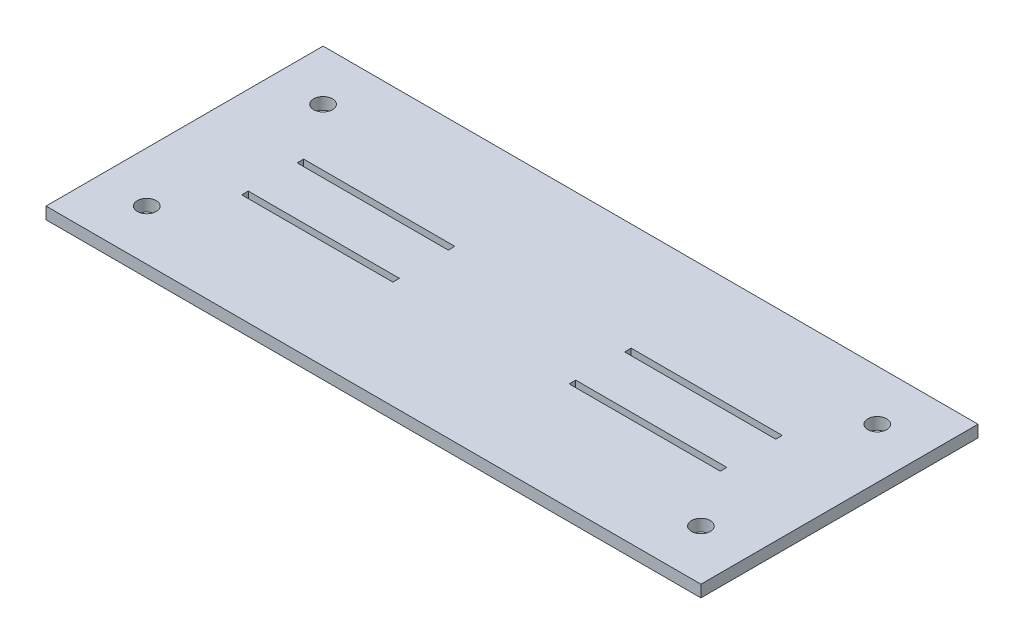
from build123d import *

# Parameters (mm, degrees)
SKETCH1_W           = 165.1
SKETCH1_H           = 69.85
BOSS_EXTRUDE1_DEPTH = 3
CUT_EXTRUDE3_REACH  = 91.684
SKETCH8_R           = 2.38125
SKETCH10_W          = 38.1
SKETCH10_H          = 1.651
CUT_EXTRUDE4_DEPTH  = 26.67


with BuildPart() as part:
    # Sketch1 → Boss-Extrude1 (new body)
    with BuildSketch(Plane(origin=(0, 0, 0), x_dir=(1, 0, 0), z_dir=(0, 1, 0))):
        Rectangle(SKETCH1_W, SKETCH1_H)
    extrude(amount=BOSS_EXTRUDE1_DEPTH)

    # Sketch8 → Cut-Extrude3 (cut, up to next)
    with BuildSketch(Plane(origin=(0, 3, 0), x_dir=(1, 0, 0), z_dir=(0, 1, 0)), mode=Mode.PRIVATE) as cut_extrude3_sk1:
        with Locations(Location((-69.85, -22.225, 0), (0, 0, 270))):
            Circle(SKETCH8_R)
    cut_extrude3_tool1 = extrude(cut_extrude3_sk1.sketch, amount=-CUT_EXTRUDE3_REACH, mode=Mode.PRIVATE) & part.part
    # Sketch8 → Cut-Extrude3 (cut, up to next)
    with BuildSketch(Plane(origin=(0, 3, 0), x_dir=(1, 0, 0), z_dir=(0, 1, 0)), mode=Mode.PRIVATE) as cut_extrude3_sk2:
        with Locations(Location((-69.85, 22.225, 0), (0, 0, 270))):
            Circle(SKETCH8_R)
    cut_extrude3_tool2 = extrude(cut_extrude3_sk2.sketch, amount=-CUT_EXTRUDE3_REACH, mode=Mode.PRIVATE) & part.part
    # Sketch8 → Cut-Extrude3 (cut, up to next)
    with BuildSketch(Plane(origin=(0, 3, 0), x_dir=(1, 0, 0), z_dir=(0, 1, 0)), mode=Mode.PRIVATE) as cut_extrude3_sk3:
        with Locations(Location((69.85, 22.225, 0), (0, 0, 270))):
            Circle(SKETCH8_R)
    cut_extrude3_tool3 = extrude(cut_extrude3_sk3.sketch, amount=-CUT_EXTRUDE3_REACH, mode=Mode.PRIVATE) & part.part
    # Sketch8 → Cut-Extrude3 (cut, up to next)
    with BuildSketch(Plane(origin=(0, 3, 0), x_dir=(1, 0, 0), z_dir=(0, 1, 0)), mode=Mode.PRIVATE) as cut_extrude3_sk4:
        with Locations(Location((69.85, -22.225, 0), (0, 0, 270))):
            Circle(SKETCH8_R)
    cut_extrude3_tool4 = extrude(cut_extrude3_sk4.sketch, amount=-CUT_EXTRUDE3_REACH, mode=Mode.PRIVATE) & part.part
    add(cut_extrude3_tool1.solids().sort_by_distance((-69.85, 3, 22.225))[0], mode=Mode.SUBTRACT)
    add(cut_extrude3_tool2.solids().sort_by_distance((-69.85, 3, -22.225))[0], mode=Mode.SUBTRACT)
    add(cut_extrude3_tool3.solids().sort_by_distance((69.85, 3, -22.225))[0], mode=Mode.SUBTRACT)
    add(cut_extrude3_tool4.solids().sort_by_distance((69.85, 3, 22.225))[0], mode=Mode.SUBTRACT)

    # Sketch10 → Cut-Extrude4 (cut)
    with BuildSketch(Plane.XZ):
        with Locations((-41.275, -6.985)):
            Rectangle(SKETCH10_W, SKETCH10_H)
        with Locations((-41.275, 6.985)):
            Rectangle(SKETCH10_W, SKETCH10_H)
        with Locations((41.275, 6.985)):
            Rectangle(SKETCH10_W, SKETCH10_H)
        with Locations((41.275, -6.985)):
            Rectangle(SKETCH10_W, SKETCH10_H)
    extrude(amount=-CUT_EXTRUDE4_DEPTH, mode=Mode.SUBTRACT)


solid = part.part
